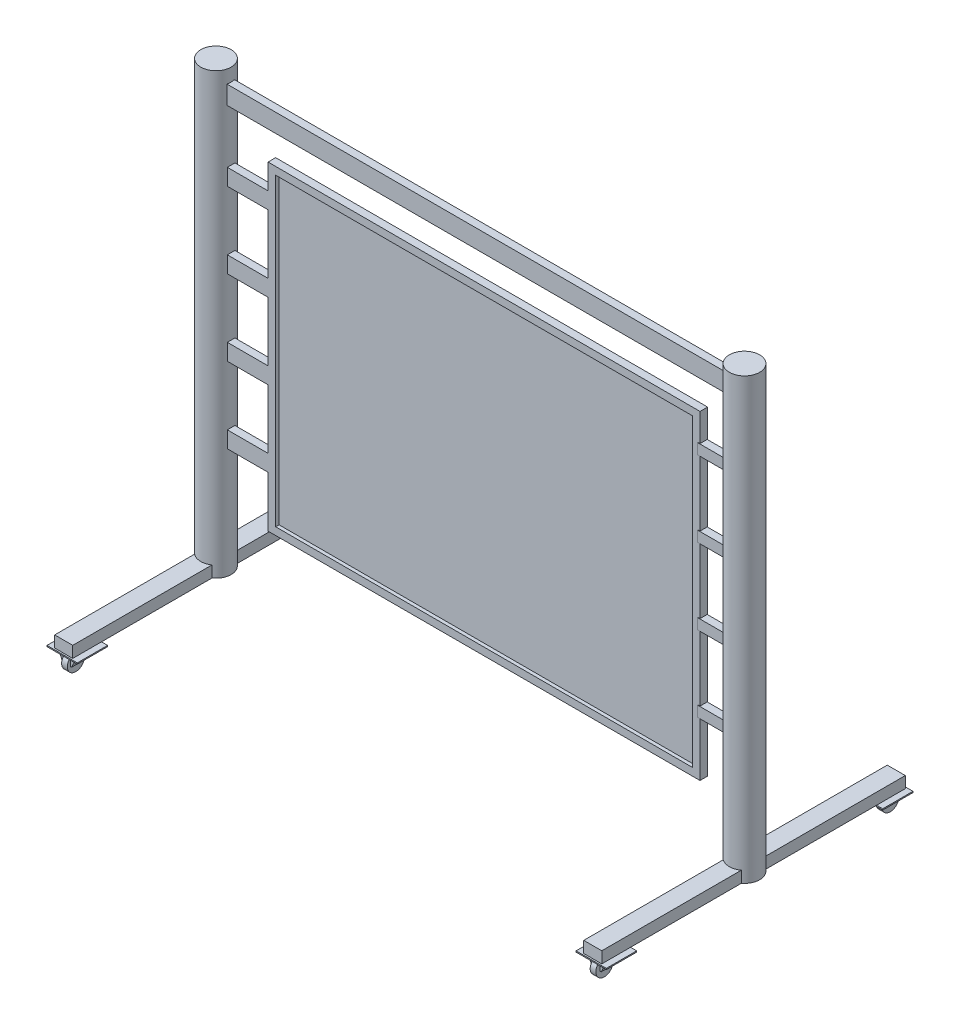
from build123d import *

# Parameters (mm, degrees)
CROQUIS1_R                   = 40
SALIENTE_EXTRUIR1_DEPTH      = 1160
SALIENTE_EXTRUIR1_2_DEPTH    = 1160
SALIENTE_EXTRUIR2_DEPTH      = 10
SALIENTE_EXTRUIR2_DEPTH_BACK = 10
CROQUIS2_W                   = 1140.024976872
CROQUIS2_H                   = 843.666256218
CROQUIS2_W_2                 = 1100.024976872
CROQUIS2_H_2                 = 803.666256218
SALIENTE_EXTRUIR3_DEPTH      = 10
SALIENTE_EXTRUIR3_DEPTH_BACK = 10
CROQUIS3_W                   = 1321.332397245
CROQUIS3_H                   = 48.514323376
CROQUIS4_W                   = 1100.024976872
CROQUIS4_H                   = 803.666256218
SALIENTE_EXTRUIR4_DEPTH      = 1
CROQUIS5_W                   = 47.621918218
CROQUIS5_H                   = 801.052509052
SALIENTE_EXTRUIR5_DEPTH      = 30
CROQUIS7_W                   = 107.487511564
CROQUIS7_H                   = 43.286165793
SALIENTE_EXTRUIR6_DEPTH      = 10
MATRIZL1_COUNT               = 4
MATRIZL1_PITCH               = 200
CROQUIS11_W                  = 72.823294088
CROQUIS11_H                  = 27.933216227
SALIENTE_EXTRUIR8_DEPTH      = 10
MATRIZL3_COUNT               = 4
MATRIZL3_PITCH               = 200
CROQUIS12_W                  = 80
CROQUIS12_H                  = 80
SALIENTE_EXTRUIR10_DEPTH     = 3
CROQUIS14_R                  = 22.5
SALIENTE_EXTRUIR12_DEPTH     = 7.5
SALIENTE_EXTRUIR12_2_DEPTH   = 7.5
MATRIZL5_COUNT               = 2
MATRIZL5_PITCH               = 1395
SALIENTE_EXTRUIR13_DEPTH     = 27.5
MATRIZL6_COUNT               = 2
MATRIZL6_PITCH               = 1395
MATRIZL7_COUNT               = 2
MATRIZL7_PITCH               = 755
SALIENTE_EXTRUIR14_DEPTH     = 27.5


with BuildPart() as part:
    # Croquis1 → Saliente-Extruir1 (new body)
    with BuildSketch(Plane(origin=(0, 0, 0), x_dir=(1, 0, 0), z_dir=(0, 1, 0))):
        Circle(CROQUIS1_R)
    extrude(amount=SALIENTE_EXTRUIR1_DEPTH)

    # Croquis3 → Saliente-Extruir3 (add, two sides: drawn at the far end of the back side and taken through both)
    with BuildSketch(Plane.XY.offset(-SALIENTE_EXTRUIR3_DEPTH_BACK)):
        with Locations((694.333801377, 1101.489319716)):
            Rectangle(CROQUIS3_W, CROQUIS3_H)
    extrude(amount=SALIENTE_EXTRUIR3_DEPTH + SALIENTE_EXTRUIR3_DEPTH_BACK)



with BuildPart() as body_2:
    # Croquis1 → Saliente-Extruir1 2 (new body)
    with BuildSketch(Plane(origin=(0, 0, 0), x_dir=(1, 0, 0), z_dir=(0, 1, 0))):
        with Locations((1395, 0)):
            Circle(CROQUIS1_R)
    extrude(amount=SALIENTE_EXTRUIR1_2_DEPTH)


with BuildPart() as body_3:
    # Croquis2 → Saliente-Extruir2 (new, two sides: drawn at the far end of the back side and taken through both)
    with BuildSketch(Plane.XY.offset(-SALIENTE_EXTRUIR2_DEPTH_BACK)):
        with Locations((717.5, 580)):
            Rectangle(CROQUIS2_W, CROQUIS2_H)
        with Locations((717.5, 580)):
            Rectangle(CROQUIS2_W_2, CROQUIS2_H_2, mode=Mode.SUBTRACT)
    extrude(amount=SALIENTE_EXTRUIR2_DEPTH + SALIENTE_EXTRUIR2_DEPTH_BACK)

    # Croquis4 → Saliente-Extruir4 (add)
    with BuildSketch(Plane.XY):
        with Locations((717.5, 580)):
            Rectangle(CROQUIS4_W, CROQUIS4_H)
    extrude(amount=SALIENTE_EXTRUIR4_DEPTH)

    # Croquis7 → Saliente-Extruir6 (add, symmetric)
    with BuildSketch(Plane.XY):
        with Locations((93.743755782, 914.349835021)):
            Rectangle(CROQUIS7_W, CROQUIS7_H)
    saliente_extruir6 = extrude(amount=SALIENTE_EXTRUIR6_DEPTH, both=True)

    # MatrizL1: Saliente-Extruir6 ×4
    with Locations(*[(0, -i * MATRIZL1_PITCH, 0) for i in range(1, MATRIZL1_COUNT)]):
        add(saliente_extruir6)

    # Croquis11 → Saliente-Extruir8 (add, symmetric)
    with BuildSketch(Plane.XY.offset(1)):
        with Locations((1318.588352956, 914.349835021)):
            Rectangle(CROQUIS11_W, CROQUIS11_H)
    saliente_extruir8 = extrude(amount=SALIENTE_EXTRUIR8_DEPTH, both=True)

    # MatrizL3: Saliente-Extruir8 ×4
    with Locations(*[(0, -i * MATRIZL3_PITCH, 0) for i in range(1, MATRIZL3_COUNT)]):
        add(saliente_extruir8)


with BuildPart() as part_1:
    add(part.part)

    add(body_2.part)  # Saliente-Extruir5 merges body 2
    # Croquis5 → Saliente-Extruir5 (add)
    with BuildSketch(Plane(origin=(0, 0, 0), x_dir=(1, 0, 0), z_dir=(0, 1, 0))):
        with Locations((1395, 0)):
            Rectangle(CROQUIS5_W, CROQUIS5_H)
        with Locations((-1.270166538, 0)):
            Rectangle(CROQUIS5_W, CROQUIS5_H)
    extrude(amount=SALIENTE_EXTRUIR5_DEPTH)

    # Croquis12 → Saliente-Extruir10 (add)
    with BuildSketch(Plane(origin=(0, 0, 0), x_dir=(-1, 0, 0), z_dir=(0, -1, 0))):
        with Locations((-1395, -364.652170086)):
            Rectangle(CROQUIS12_W, CROQUIS12_H)
        with Locations((1.270166538, -364.652170086)):
            Rectangle(CROQUIS12_W, CROQUIS12_H)
        with Locations((1.270166538, 364.652170086)):
            Rectangle(CROQUIS12_W, CROQUIS12_H)
        with Locations((-1395, 364.652170086)):
            Rectangle(CROQUIS12_W, CROQUIS12_H)
    extrude(amount=SALIENTE_EXTRUIR10_DEPTH)

    # Croquis15 → Saliente-Extruir13 (add)
    with BuildSketch(Plane(origin=(0, 0, -392.652170086), x_dir=(-1, 0, 0), z_dir=(0, 0, -1))):
        Polygon((-1372.261755051, -3), (-1386.263578414, -3), (-1386.263578414, -29.620242337), (-1382.557213406, -29.620242337), align=None)
        Polygon((-1419.270281928, -3), (-1406.593029208, -29.620242337), (-1403.28095424, -29.620242337), (-1403.28095424, -3), align=None)
    saliente_extruir13 = extrude(amount=-SALIENTE_EXTRUIR13_DEPTH)

    # MatrizL6: Saliente-Extruir13 ×2
    with Locations(*[(-i * MATRIZL6_PITCH, 0, 0) for i in range(1, MATRIZL6_COUNT)]):
        add(saliente_extruir13)

    # MatrizL7: Saliente-Extruir13 ×2
    with Locations(*[(0, 0, i * MATRIZL7_PITCH) for i in range(1, MATRIZL7_COUNT)]):
        add(saliente_extruir13)

    # Croquis16 → Saliente-Extruir14 (add)
    with BuildSketch(Plane.XY.offset(392.652170086)):
        Polygon((-8.736421586, -29.620242337), (-12.442786594, -29.620242337), (-22.738244949, -3), (-8.736421586, -3), align=None)
        Polygon((8.28095424, -29.620242337), (11.593029208, -29.620242337), (24.270281928, -3), (8.28095424, -3), align=None)
    extrude(amount=-SALIENTE_EXTRUIR14_DEPTH)


with BuildPart() as body_3_2:
    # Croquis14 → Saliente-Extruir12 (new, symmetric)
    with BuildSketch(Plane.ZY.offset(0.081125647)):
        with Locations((-377.308474862, -26.942313408)):
            Circle(CROQUIS14_R)
    saliente_extruir12 = extrude(amount=SALIENTE_EXTRUIR12_DEPTH, both=True)


with BuildPart() as body_4:
    # Croquis14 → Saliente-Extruir12 2 (new, symmetric)
    with BuildSketch(Plane.ZY.offset(0.081125647)):
        with Locations((377.308474862, -26.942313408)):
            Circle(CROQUIS14_R)
    saliente_extruir12_2 = extrude(amount=SALIENTE_EXTRUIR12_2_DEPTH, both=True)


with BuildPart() as matrizl5_1:
    # MatrizL5: Saliente-Extruir12, Saliente-Extruir12 2 ×2
    with Locations(*[(i * MATRIZL5_PITCH, 0, 0) for i in range(1, MATRIZL5_COUNT)]):
        add(saliente_extruir12)
        add(saliente_extruir12_2)


solid = Compound([body_3.part, part_1.part, body_3_2.part, body_4.part, matrizl5_1.part])
